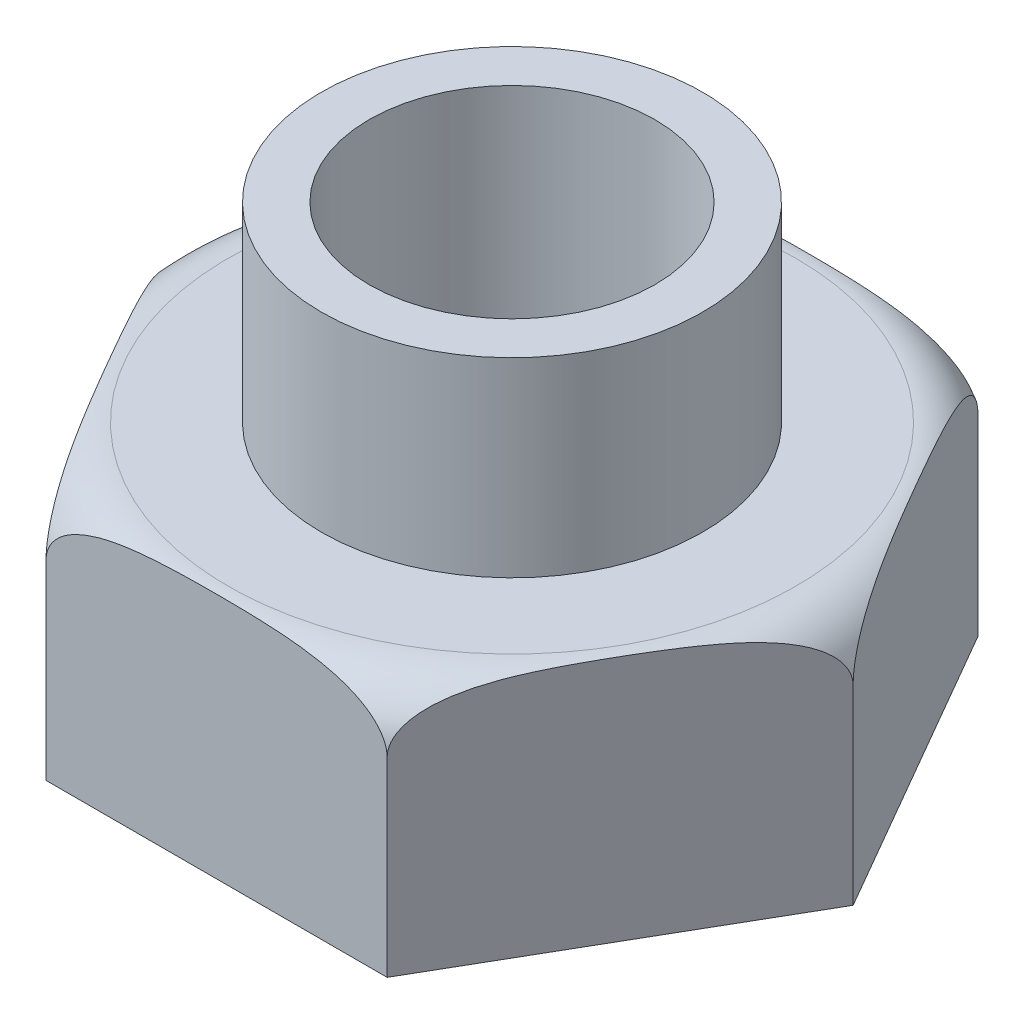
from build123d import *

# Parameters (mm, degrees)
BOSS_EXTRUDE1_DEPTH     = 65
SKETCH4_R               = 50
BOSS_EXTRUDE2_DEPTH     = 50
CUT_EXTRUDE1_DEPTH      = 166.044186174
CUT_EXTRUDE1_DEPTH_BACK = 166.044186174
SKETCH5_R               = 37.5


with BuildPart() as part:
    # Sketch1 → Boss-Extrude1 (new body)
    with BuildSketch(Plane(origin=(0, 0, 0), x_dir=(1, 0, 0), z_dir=(0, 1, 0))):
        Polygon((-44.744645862, -77.5), (44.744645862, -77.5), (89.489291724, 0), (-89.489291724, 0), align=None)
        Polygon((-89.489291724, 0), (89.489291724, 0), (44.744645862, 77.5), (-44.744645862, 77.5), align=None)
    extrude(amount=BOSS_EXTRUDE1_DEPTH)

    # Sketch2 → Cut-Revolve1 (revolve, cut)
    with BuildSketch(Plane.XY, mode=Mode.PRIVATE) as cut_revolve1_sk:
        with BuildLine():
            Line((74.489291724, 65), (74.489291724, 71.033853329))
            Line((74.489291724, 71.033853329), (95.90922918, 71.033853329))
            Line((95.90922918, 71.033853329), (95.90922918, 50))
            Line((95.90922918, 50), (89.489291724, 50))
            ThreePointArc((89.489291724, 50), (85.095893442, 60.606601718), (74.489291724, 65))
        make_face()
    revolve(cut_revolve1_sk.sketch.rotate(Axis((0, 0, 0), (0, 1, 0)), 90), axis=Axis((0, 0, 0), (0, 1, 0)), mode=Mode.SUBTRACT)

    # Sketch4 → Boss-Extrude2 (add)
    with BuildSketch(Plane(origin=(0, 65, 0), x_dir=(1, 0, 0), z_dir=(0, 1, 0))):
        with Locations(Location((0, 0, 0), (0, 0, 270))):
            Circle(SKETCH4_R)
    extrude(amount=BOSS_EXTRUDE2_DEPTH)

    # Sketch5 → Cut-Extrude1 (cut, two sides: drawn at the far end of the back side and taken through both)
    with BuildSketch(Plane(origin=(0, 115, 0), x_dir=(1, 0, 0), z_dir=(0, 1, 0)).offset(-CUT_EXTRUDE1_DEPTH_BACK)):
        with Locations(Location((0, 0, 0), (0, 0, 270))):
            Circle(SKETCH5_R)
    extrude(amount=CUT_EXTRUDE1_DEPTH + CUT_EXTRUDE1_DEPTH_BACK, mode=Mode.SUBTRACT)


solid = part.part
